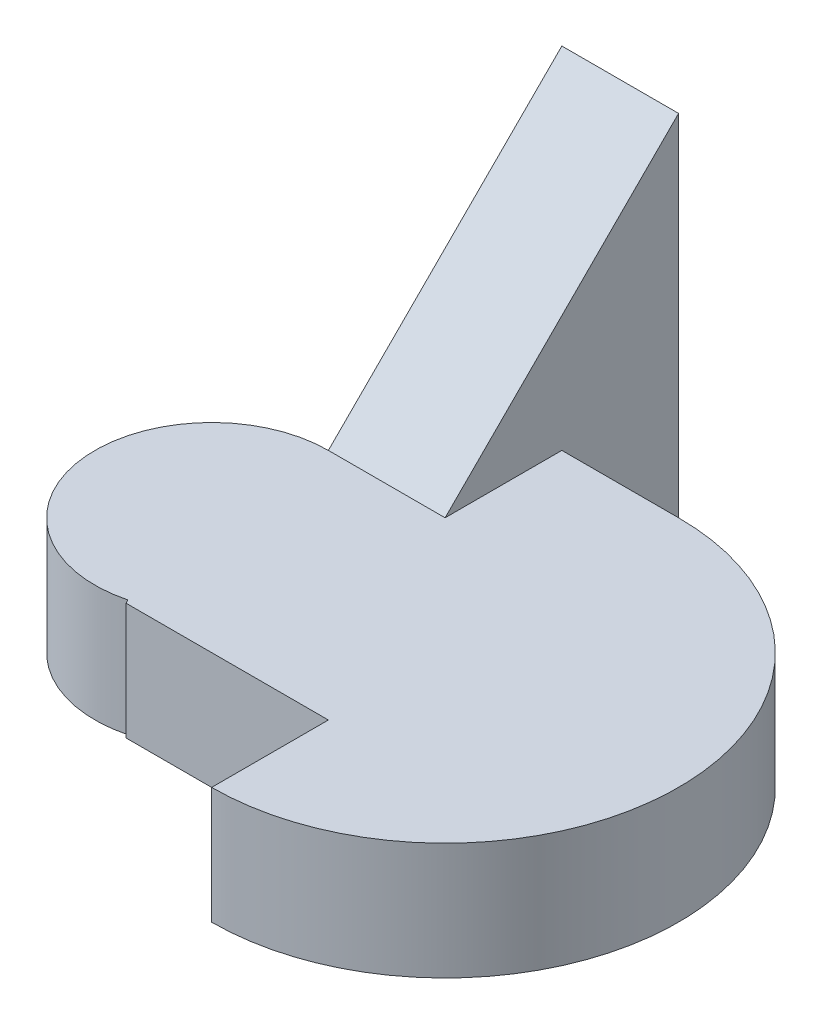
from build123d import *

# Parameters (mm, degrees)
EXTRUDE_1_DEPTH     = 10
SKETCH_2_W          = 10
SKETCH_2_H          = 20
EXTRUDE_2_DEPTH     = 30
CUT_EXTRUDE_1_DEPTH = 30


with BuildPart() as part:
    # 草圖1 → 填料-伸長1 (new body)
    with BuildSketch(Plane(origin=(0, 0, 0), x_dir=(1, 0, 0), z_dir=(0, 1, 0))):
        with BuildLine():
            Line((0, 10), (0, 0))
            Line((0, 0), (-10, 0))
            Line((-10, 0), (-10, -20))
            ThreePointArc((-10, -20), (-8.739957075, -19.920296963), (-7.5, -19.682458366))
            ThreePointArc((-7.5, -19.682458366), (-7.410977969, -19.841638388), (-7.320508076, -20))
            Line((-7.320508076, -20), (10, -20))
            Line((10, -20), (10, 10))
            Line((10, 10), (0, 10))
        make_face()
        with BuildLine():
            Line((-10, -20), (-10, 0))
            ThreePointArc((-10, 0), (-20, -10), (-10, -20))
        make_face()
        with BuildLine():
            Line((10, -20), (10, -30))
            ThreePointArc((10, -30), (30, -10), (10, 10))
            Line((10, 10), (10, -20))
        make_face()
    extrude(amount=EXTRUDE_1_DEPTH)

    # 草圖2 → 填料-伸長2 (add)
    with BuildSketch(Plane.XZ):
        with Locations((-5, -10)):
            Rectangle(SKETCH_2_W, SKETCH_2_H)
    extrude(amount=-EXTRUDE_2_DEPTH)

    # 草圖3 → 除料-伸長1 (cut)
    with BuildSketch(Plane(origin=(0, 0, 0), x_dir=(0, 0, -1), z_dir=(1, 0, 0))):
        Polygon((20, 30), (0, 10), (0, 30), align=None)
    extrude(amount=-CUT_EXTRUDE_1_DEPTH, mode=Mode.SUBTRACT)


solid = part.part
